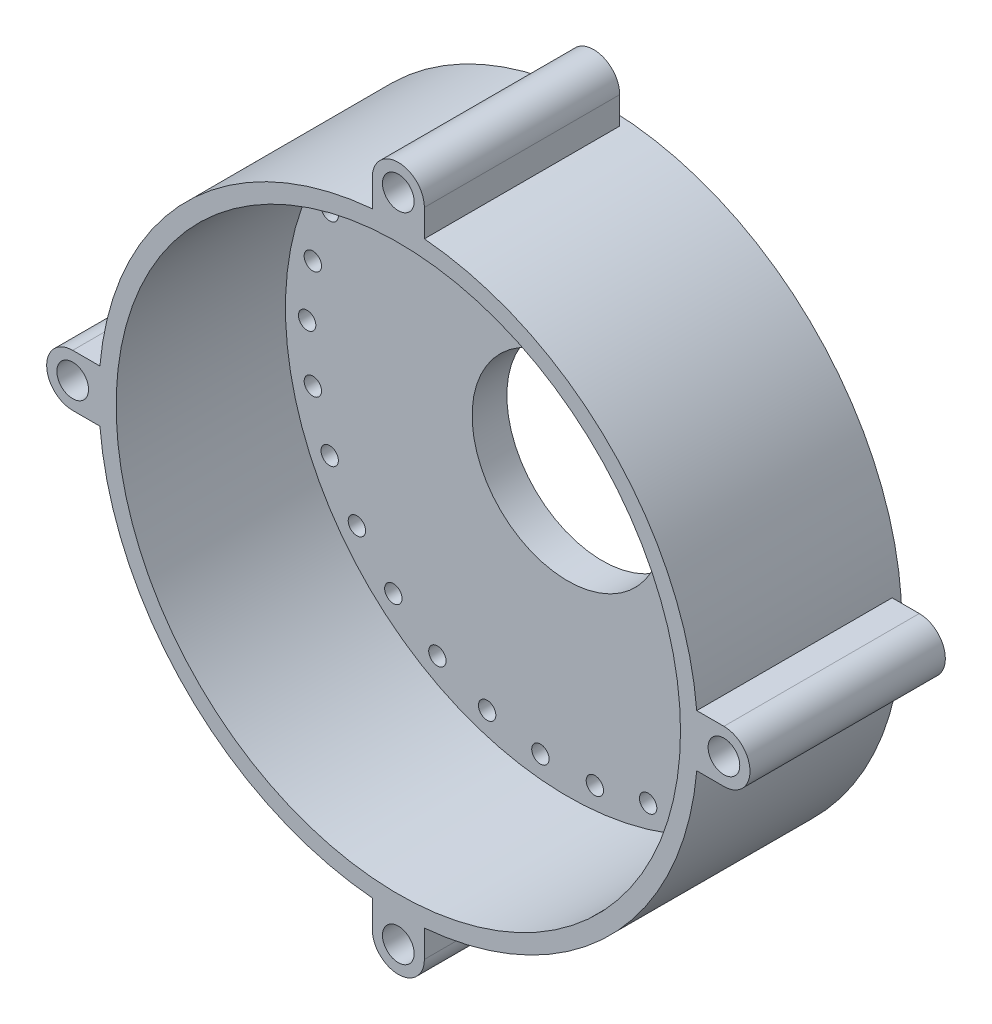
from build123d import *

# Parameters (mm, degrees)
SKETCH1_R                  = 54.76875
BOSS_EXTRUDE1_DEPTH        = 37.30625
SKETCH2_R                  = 51.59375
CUT_EXTRUDE1_DEPTH         = 30.95625
SKETCH3_R                  = 1.5875
CUT_EXTRUDE2_DEPTH         = 3.175
SKETCH4_R                  = 17.4625
CUT_EXTRUDE3_DEPTH         = 84.411757967
BOSS_EXTRUDE2_START        = -35.71875
BOSS_EXTRUDE2_DEPTH        = 35.71875
F_1_0_228_DIAMETER_HOLE1_D = 5.7912


with BuildPart() as part:
    # Sketch1 → Boss-Extrude1 (new body)
    with BuildSketch(Plane.XY):
        Circle(SKETCH1_R)
    extrude(amount=BOSS_EXTRUDE1_DEPTH)

    # Sketch2 → Cut-Extrude1 (cut)
    with BuildSketch(Plane.XY.offset(37.30625)):
        Circle(SKETCH2_R)
    extrude(amount=-CUT_EXTRUDE1_DEPTH, mode=Mode.SUBTRACT)

    # Sketch3 → Cut-Extrude2 (cut)
    with BuildSketch(Plane.XY.offset(6.35)):
        with Locations((-47.625, 0)):
            Circle(SKETCH3_R)
        with Locations((-46.584279485, 9.901794275)):
            Circle(SKETCH3_R)
        with Locations((-43.50760242, 19.370832626)):
            Circle(SKETCH3_R)
        with Locations((-38.529434357, 27.99327264)):
            Circle(SKETCH3_R)
        with Locations((-31.867345128, 35.392272313)):
            Circle(SKETCH3_R)
        with Locations((-23.8125, 41.244459855)):
            Circle(SKETCH3_R)
        with Locations((-14.716934357, 45.294066589)):
            Circle(SKETCH3_R)
        with Locations((-4.978168063, 47.364105267)):
            Circle(SKETCH3_R)
        with Locations((4.978168063, 47.364105267)):
            Circle(SKETCH3_R)
        with Locations((14.716934357, 45.294066589)):
            Circle(SKETCH3_R)
        with Locations((23.8125, 41.244459855)):
            Circle(SKETCH3_R)
        with Locations((31.867345128, 35.392272313)):
            Circle(SKETCH3_R)
        with Locations((38.529434357, 27.99327264)):
            Circle(SKETCH3_R)
        with Locations((43.50760242, 19.370832626)):
            Circle(SKETCH3_R)
        with Locations((46.584279485, 9.901794275)):
            Circle(SKETCH3_R)
        with Locations((47.625, 0)):
            Circle(SKETCH3_R)
        with Locations((46.584279485, -9.901794275)):
            Circle(SKETCH3_R)
        with Locations((43.50760242, -19.370832626)):
            Circle(SKETCH3_R)
        with Locations((38.529434357, -27.99327264)):
            Circle(SKETCH3_R)
        with Locations((31.867345128, -35.392272313)):
            Circle(SKETCH3_R)
        with Locations((23.8125, -41.244459855)):
            Circle(SKETCH3_R)
        with Locations((14.716934357, -45.294066589)):
            Circle(SKETCH3_R)
        with Locations((4.978168063, -47.364105267)):
            Circle(SKETCH3_R)
        with Locations((-4.978168063, -47.364105267)):
            Circle(SKETCH3_R)
        with Locations((-14.716934357, -45.294066589)):
            Circle(SKETCH3_R)
        with Locations((-23.8125, -41.244459855)):
            Circle(SKETCH3_R)
        with Locations((-31.867345128, -35.392272313)):
            Circle(SKETCH3_R)
        with Locations((-38.529434357, -27.99327264)):
            Circle(SKETCH3_R)
        with Locations((-43.50760242, -19.370832626)):
            Circle(SKETCH3_R)
        with Locations((-46.584279485, -9.901794275)):
            Circle(SKETCH3_R)
    extrude(amount=-CUT_EXTRUDE2_DEPTH, mode=Mode.SUBTRACT)

    # Sketch4 → Cut-Extrude3 (cut, through all)
    with BuildSketch(Plane.XY.offset(6.35)):
        Circle(SKETCH4_R)
    extrude(amount=-CUT_EXTRUDE3_DEPTH, mode=Mode.SUBTRACT)

    # Sketch7 → Boss-Extrude2 (add)
    with BuildSketch(Plane.XY.offset(37.30625).offset(BOSS_EXTRUDE2_START)):
        with BuildLine():
            Line((-54.561291868, 4.7625), (-59.53125, 4.7625))
            ThreePointArc((-59.53125, 4.7625), (-64.29375, 0), (-59.53125, -4.7625))
            Line((-59.53125, -4.7625), (-54.561291868, -4.7625))
            ThreePointArc((-54.561291868, -4.7625), (-54.76875, 0), (-54.561291868, 4.7625))
        make_face()
        with BuildLine():
            Line((-4.7625, 59.53125), (-4.7625, 54.561291868))
            ThreePointArc((-4.7625, 54.561291868), (0, 54.76875), (4.7625, 54.561291868))
            Line((4.7625, 54.561291868), (4.7625, 59.53125))
            ThreePointArc((4.7625, 59.53125), (0, 64.29375), (-4.7625, 59.53125))
        make_face()
        with BuildLine():
            ThreePointArc((4.7625, -54.561291868), (0, -54.76875), (-4.7625, -54.561291868))
            Line((-4.7625, -54.561291868), (-4.7625, -59.53125))
            ThreePointArc((-4.7625, -59.53125), (0, -64.29375), (4.7625, -59.53125))
            Line((4.7625, -59.53125), (4.7625, -54.561291868))
        make_face()
        with BuildLine():
            Line((59.53125, 4.7625), (54.561291868, 4.7625))
            ThreePointArc((54.561291868, 4.7625), (54.76875, 0), (54.561291868, -4.7625))
            Line((54.561291868, -4.7625), (59.53125, -4.7625))
            ThreePointArc((59.53125, -4.7625), (64.29375, 0), (59.53125, 4.7625))
        make_face()
    extrude(amount=BOSS_EXTRUDE2_DEPTH)

    # #1 (0.228) Diameter Hole1 (through all)
    with Locations(Plane.XY.offset(37.30625)):
        with Locations((-59.53125, 0), (0, 59.53125), (59.53125, 0), (0, -59.53125)):
            Hole(F_1_0_228_DIAMETER_HOLE1_D / 2)


solid = part.part
